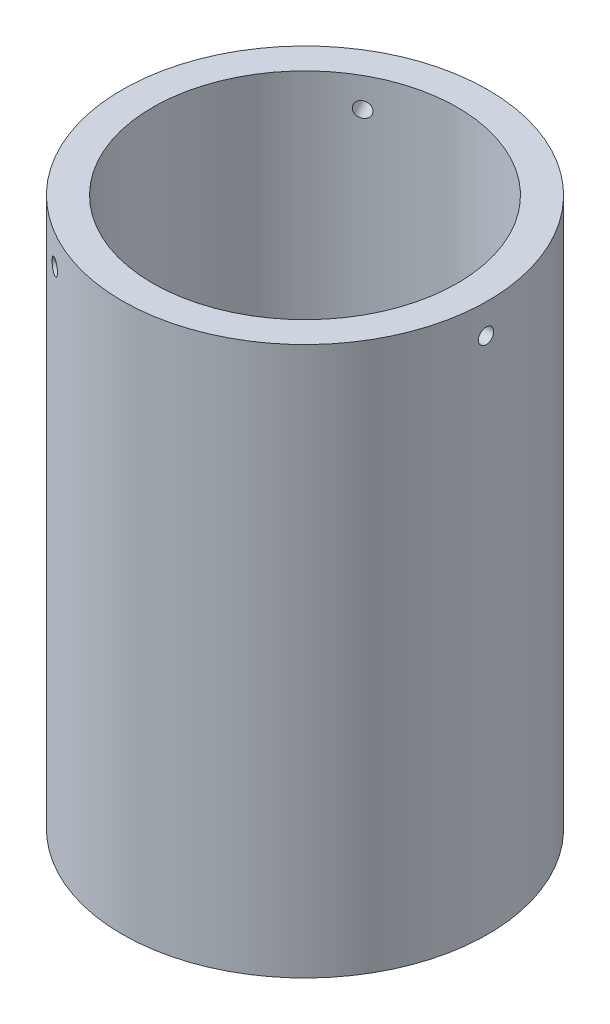
from build123d import *

# Parameters (mm, degrees)
SKETCH1_R                          = 19.05
BOSS_EXTRUDE1_DEPTH                = 57.15
SKETCH2_R                          = 15.875
CUT_EXTRUDE1_DEPTH                 = 53.975
SKETCH3_R                          = 6.35
CUT_EXTRUDE2_DEPTH                 = 48.26
F_1_16_0_0625_DIAMETER_HOLE1_D     = 1.5875
F_1_16_0_0625_DIAMETER_HOLE1_DEPTH = 13.97
CIRPATTERN1_COUNT                  = 3


with BuildPart() as part:
    # Sketch1 → Boss-Extrude1 (new body)
    with BuildSketch(Plane(origin=(0, 0, 0), x_dir=(1, 0, 0), z_dir=(0, 1, 0))):
        with Locations(Location((0.524325323, 0, 0), (0, 0, 270))):
            Circle(SKETCH1_R)
    extrude(amount=BOSS_EXTRUDE1_DEPTH)

    # Sketch2 → Cut-Extrude1 (cut)
    with BuildSketch(Plane(origin=(0, 57.15, 0), x_dir=(1, 0, 0), z_dir=(0, 1, 0))):
        with Locations(Location((0.524325323, 0, 0), (0, 0, 270))):
            Circle(SKETCH2_R)
    extrude(amount=-CUT_EXTRUDE1_DEPTH, mode=Mode.SUBTRACT)

    # Sketch3 → Cut-Extrude2 (cut)
    with BuildSketch(Plane(origin=(0, 0, 0), x_dir=(-1, 0, 0), z_dir=(0, -1, 0))):
        with Locations(Location((0, 0, 0), (0, 0, 90))):
            Circle(SKETCH3_R)
    extrude(amount=-CUT_EXTRUDE2_DEPTH, mode=Mode.SUBTRACT)

    # 1/16 (0.0625) Diameter Hole1
    with Locations(Plane(origin=(16.398633507, 54.077107179, 0.148204826), x_dir=(0.009335737046, 0, -0.999956421057), z_dir=(-0.999956421057, 0, -0.009335737046))):
        with Locations((0, 0)):
            f_1_16_0_0625_diameter_hole1 = Hole(F_1_16_0_0625_DIAMETER_HOLE1_D / 2, depth=F_1_16_0_0625_DIAMETER_HOLE1_DEPTH)

    # CirPattern1: 1/16 (0.0625) Diameter Hole1 ×3 about axis
    cirpattern1_axis = Axis((0.524325323, 57.15, 0), (0, -1, 0))
    for i in range(1, CIRPATTERN1_COUNT):
        add(f_1_16_0_0625_diameter_hole1.rotate(cirpattern1_axis, i * 360 / CIRPATTERN1_COUNT), mode=Mode.SUBTRACT)


solid = part.part
